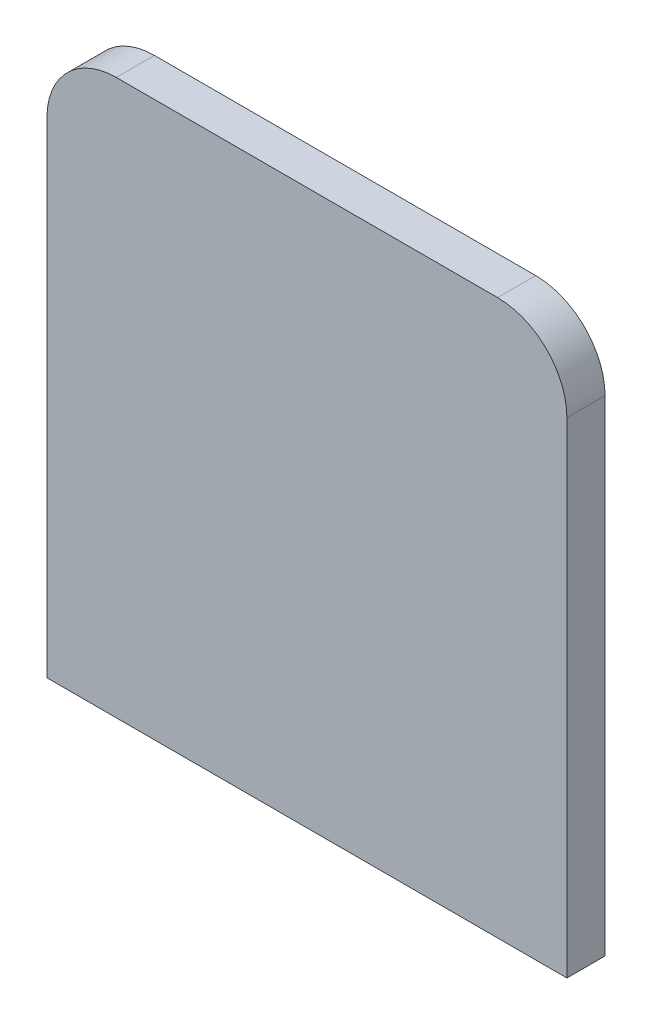
from build123d import *

# Parameters (mm, degrees)
EXTRUDE_1_DEPTH = 1.1


with BuildPart() as part:
    # 草图1 → 凸台-拉伸1 (new body)
    with BuildSketch(Plane.XY):
        with BuildLine():
            Line((0, 16), (5.5, 16))
            ThreePointArc((5.5, 16), (6.914213562, 15.414213562), (7.5, 14))
            Line((7.5, 14), (7.5, 0))
            Line((7.5, 0), (0, 0))
            Line((0, 0), (-7.5, 0))
            Line((-7.5, 0), (-7.5, 14))
            ThreePointArc((-7.5, 14), (-6.914213562, 15.414213562), (-5.5, 16))
            Line((-5.5, 16), (0, 16))
        make_face()
    extrude(amount=EXTRUDE_1_DEPTH)


solid = part.part
